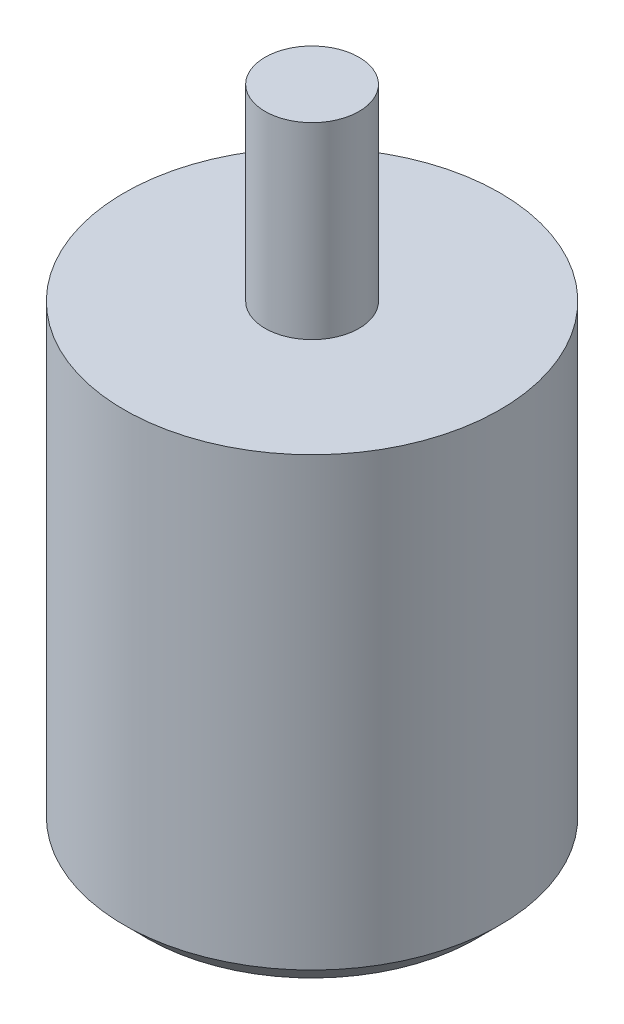
from build123d import *

# Parameters (mm, degrees)
CHAMFER1_SIZE = 1.5875


with BuildPart() as part:
    # Sketch1 → Revolve1 (revolve)
    with BuildSketch(Plane.XY, mode=Mode.PRIVATE) as revolve1_sk:
        Polygon((0, 0), (0, 44.45), (3.175, 44.45), (3.175, 31.75), (12.7, 31.75), (12.7, 0), align=None)
    revolve(revolve1_sk.sketch.rotate(Axis((0, 0, 0), (0, 1, 0)), 90), axis=Axis((0, 0, 0), (0, 1, 0)))

    # Chamfer1
    chamfer1_edges = [part.edges().sort_by_distance(p)[0] for p in [
        (0, 0, 12.7),
    ]]
    chamfer(chamfer1_edges, length=CHAMFER1_SIZE)


solid = part.part
